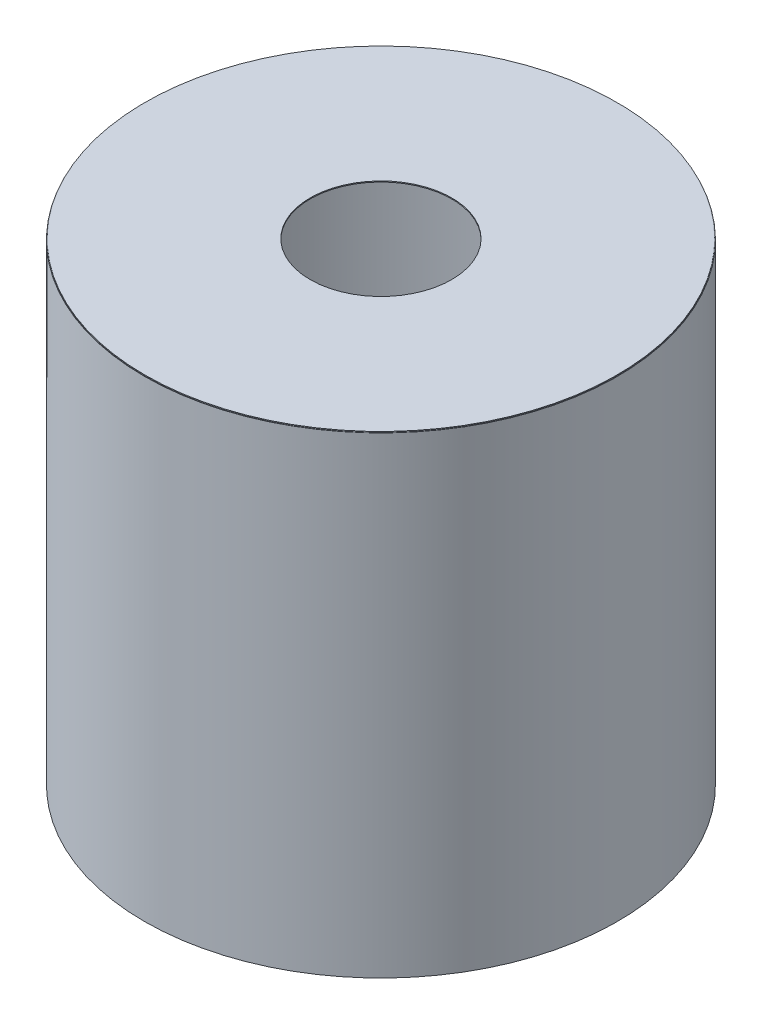
from build123d import *

# Parameters (mm, degrees)
SKETCH1_R           = 501
SKETCH1_R_2         = 500
BOSS_EXTRUDE1_DEPTH = 1000
SKETCH2_R           = 500
SKETCH2_R_2         = 150
BOSS_EXTRUDE2_DEPTH = 2
SKETCH3_R           = 450
SKETCH3_R_2         = 100
BOSS_EXTRUDE3_DEPTH = 2


with BuildPart() as part:
    # Sketch1 → Boss-Extrude1 (new body)
    with BuildSketch(Plane(origin=(0, 800, 0), x_dir=(1, 0, 0), z_dir=(0, 1, 0))):
        with Locations(Location((0, 0, 0), (0, 0, 270))):
            Circle(SKETCH1_R)
        with Locations(Location((0, 0, 0), (0, 0, 270))):
            Circle(SKETCH1_R_2, mode=Mode.SUBTRACT)
    extrude(amount=BOSS_EXTRUDE1_DEPTH)


with BuildPart() as body_2:
    # Sketch2 → Boss-Extrude2 (new body)
    with BuildSketch(Plane(origin=(0, 1800, 0), x_dir=(1, 0, 0), z_dir=(0, 1, 0))):
        with Locations(Location((0, 0, 0), (0, 0, 270))):
            Circle(SKETCH2_R)
        with Locations(Location((0, 0, 0), (0, 0, 270))):
            Circle(SKETCH2_R_2, mode=Mode.SUBTRACT)
    extrude(amount=BOSS_EXTRUDE2_DEPTH)


with BuildPart() as body_3:
    # Sketch3 → Boss-Extrude3 (new body)
    with BuildSketch(Plane(origin=(0, 1200, 0), x_dir=(1, 0, 0), z_dir=(0, 1, 0))):
        with Locations(Location((0, 0, 0), (0, 0, 270))):
            Circle(SKETCH3_R)
        with Locations(Location((0, 0, 0), (0, 0, 270))):
            Circle(SKETCH3_R_2, mode=Mode.SUBTRACT)
    extrude(amount=BOSS_EXTRUDE3_DEPTH)


solid = Compound([part.part, body_2.part, body_3.part])
